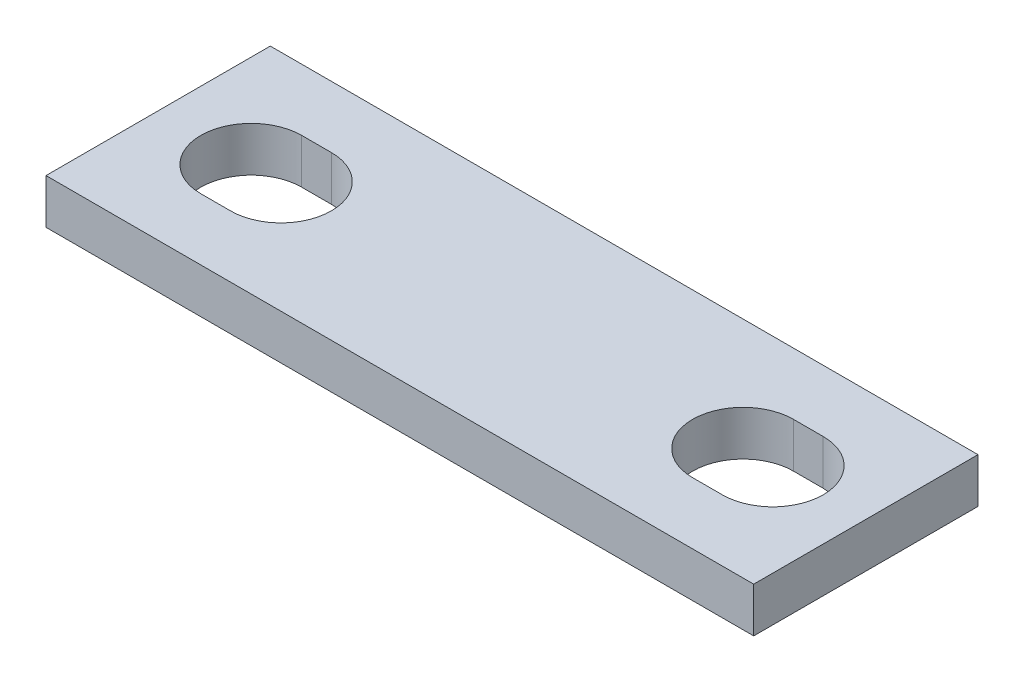
from build123d import *

# Parameters (mm, degrees)
SKETCH1_W    = 31.55
SKETCH1_H    = 10
BUSBAR_DEPTH = 2


with BuildPart() as part:
    # Sketch1 → Busbar (new body)
    with BuildSketch(Plane(origin=(0, 0, 0), x_dir=(1, 0, 0), z_dir=(0, 1, 0))):
        Rectangle(SKETCH1_W, SKETCH1_H)
        with BuildLine():
            Line((-11.625, 2.25), (-10.3, 2.25))
            ThreePointArc((-10.3, 2.25), (-8.05, 0), (-10.3, -2.25))
            Line((-10.3, -2.25), (-11.625, -2.25))
            ThreePointArc((-11.625, -2.25), (-13.875, 0), (-11.625, 2.25))
        make_face(mode=Mode.SUBTRACT)
        with BuildLine():
            Line((11.625, -2.25), (10.3, -2.25))
            ThreePointArc((10.3, -2.25), (8.05, 0), (10.3, 2.25))
            Line((10.3, 2.25), (11.625, 2.25))
            ThreePointArc((11.625, 2.25), (13.875, 0), (11.625, -2.25))
        make_face(mode=Mode.SUBTRACT)
    extrude(amount=BUSBAR_DEPTH)


solid = part.part
